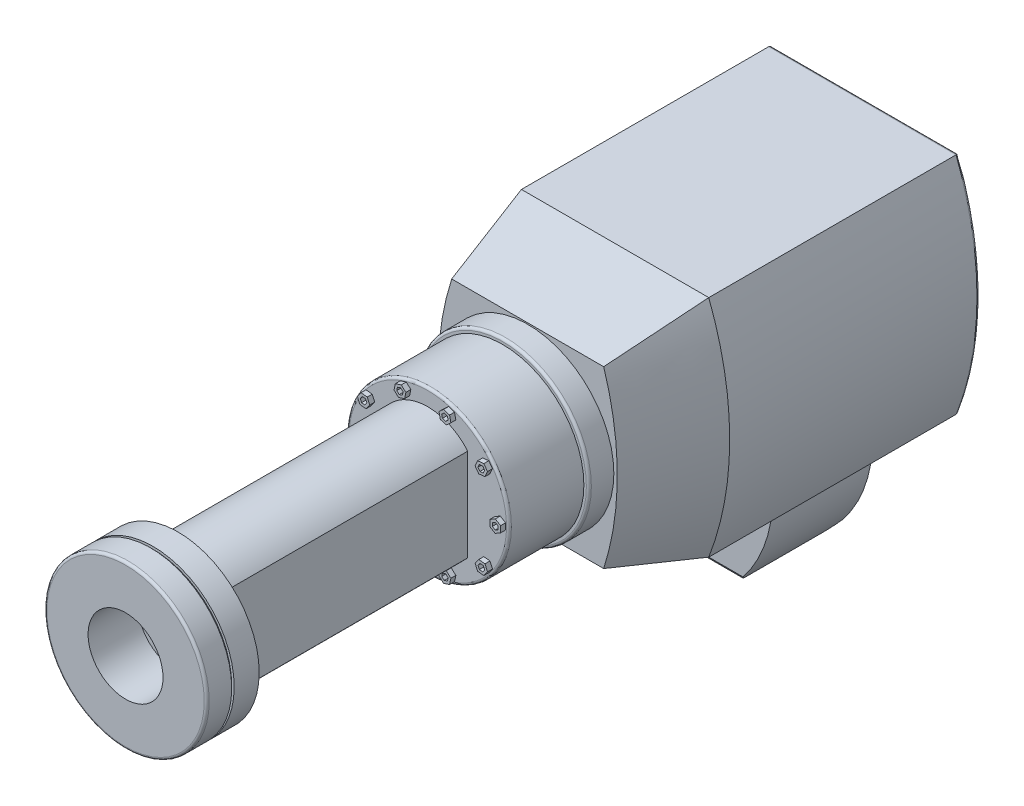
from build123d import *

# Parameters (mm, degrees)
BOSS_EXTRUDE1_DEPTH  = 100
SKETCH4_R            = 34.5
BOSS_EXTRUDE2_DEPTH  = 10
SKETCH5_R            = 32.5
BOSS_EXTRUDE3_DEPTH  = 30
BOSS_EXTRUDE4_DEPTH  = 2
CIRPATTERN1_COUNT    = 10
BOSS_EXTRUDE5_DEPTH  = 100
SKETCH11_R           = 32.5
BOSS_EXTRUDE6_DEPTH  = 10
SKETCH12_R           = 31.5
BOSS_EXTRUDE7_DEPTH  = 1
SKETCH13_R           = 32.5
BOSS_EXTRUDE8_DEPTH  = 10
SKETCH14_R           = 42.5
BOSS_EXTRUDE9_DEPTH  = 10.5
BOSS_EXTRUDE10_DEPTH = 35
BOSS_EXTRUDE11_DEPTH = 20
CUT_EXTRUDE1_DEPTH   = 314.700892617
FILLET1_R            = 1
SKETCH18_R           = 15
CUT_EXTRUDE2_DEPTH   = 20
SKETCH19_R           = 15
CUT_EXTRUDE3_DEPTH   = 20


with BuildPart() as part:
    # Sketch1 → Boss-Extrude1 (new body)
    with BuildSketch(Plane.XY):
        with BuildLine():
            Line((37.5, 45), (-37.5, 45))
            ThreePointArc((-37.5, 45), (-45.880962103, 0), (-37.5, -45))
            Line((-37.5, -45), (37.5, -45))
            ThreePointArc((37.5, -45), (45.880962103, 0), (37.5, 45))
        make_face()
    extrude(amount=BOSS_EXTRUDE1_DEPTH)

    # Sketch3 for Loft1 → Loft1 section 0
    with BuildSketch(Plane.XY.offset(135)):
        with BuildLine():
            Line((30.425473604, 35), (-30.425473604, 35))
            # circular arc as an exact rational Bezier (weights 1, cos(half-angle), 1)
            Bezier((-30.425473604, 35), (-41.608142487, 0), (-30.425473604, -35), weights=[1, 0.95256097, 1])
            Line((-30.425473604, -35), (30.425473604, -35))
            Bezier((30.425473604, -35), (41.608142487, 0), (30.425473604, 35), weights=[1, 0.95256097, 1])
        make_face()
    # Sketch2 for Loft1 → Loft1 section 1
    with BuildSketch(Plane.XY.offset(100)):
        with BuildLine():
            Line((37.5, 45), (-37.5, 45))
            Bezier((-37.5, 45), (-54.864231746, 0), (-37.5, -45), weights=[1, 0.932952303, 1])
            Line((-37.5, -45), (37.5, -45))
            Bezier((37.5, -45), (54.864231746, 0), (37.5, 45), weights=[1, 0.932952303, 1])
        make_face()
    loft()

    # Sketch4 → Boss-Extrude2 (add)
    with BuildSketch(Plane.XY.offset(135)):
        Circle(SKETCH4_R)
    extrude(amount=BOSS_EXTRUDE2_DEPTH)

    # Sketch5 → Boss-Extrude3 (add)
    with BuildSketch(Plane.XY.offset(145)):
        Circle(SKETCH5_R)
    extrude(amount=BOSS_EXTRUDE3_DEPTH)

    # Sketch6 → Boss-Extrude4 (add)
    with BuildSketch(Plane.XY.offset(175)):
        Polygon((29, -2.5), (31.165063509, -1.25), (31.165063509, 1.25), (29, 2.5), (26.834936491, 1.25), (26.834936491, -1.25), align=None)
        Polygon((30.165063509, 0.672649731), (29, 1.345299462), (27.834936491, 0.672649731), (27.834936491, -0.672649731), (29, -1.345299462), (30.165063509, -0.672649731), align=None, mode=Mode.SUBTRACT)
    boss_extrude4 = extrude(amount=BOSS_EXTRUDE4_DEPTH)

    # CirPattern1: Boss-Extrude4 ×10 about axis
    cirpattern1_axis = Axis((-0.142607945, 0, 0), (0, 0, 1))
    for i in range(1, CIRPATTERN1_COUNT):
        add(boss_extrude4.rotate(cirpattern1_axis, i * 360 / CIRPATTERN1_COUNT))

    # Sketch9 → Boss-Extrude5 (add)
    with BuildSketch(Plane.XY.offset(175)):
        with BuildLine():
            Line((16, 18.5), (16, -18.5))
            ThreePointArc((16, -18.5), (0, -25.898529491), (-16, -18.5))
            Line((-16, -18.5), (-16, 18.5))
            ThreePointArc((-16, 18.5), (0, 25.898529491), (16, 18.5))
        make_face()
    extrude(amount=BOSS_EXTRUDE5_DEPTH)

    # Sketch11 → Boss-Extrude6 (add)
    with BuildSketch(Plane.XY.offset(275)):
        Circle(SKETCH11_R)
    extrude(amount=BOSS_EXTRUDE6_DEPTH)

    # Sketch12 → Boss-Extrude7 (add)
    with BuildSketch(Plane.XY.offset(285)):
        Circle(SKETCH12_R)
    extrude(amount=BOSS_EXTRUDE7_DEPTH)

    # Sketch13 → Boss-Extrude8 (add)
    with BuildSketch(Plane.XY.offset(286)):
        Circle(SKETCH13_R)
    extrude(amount=BOSS_EXTRUDE8_DEPTH)

    # Sketch14 → Boss-Extrude9 (add, symmetric)
    with BuildSketch(Plane(origin=(-37.5, 0, 0), x_dir=(0, 0, -1), z_dir=(1, 0, 0))):
        with Locations((-50, -45)):
            Circle(SKETCH14_R)
    extrude(amount=BOSS_EXTRUDE9_DEPTH, both=True)

    # Sketch15 → Boss-Extrude10 (add)
    with BuildSketch(Plane(origin=(-27, 0, 0), x_dir=(0, 0, -1), z_dir=(1, 0, 0))):
        with BuildLine():
            Line((-70, -45), (-70, -75))
            ThreePointArc((-70, -75), (-50, -85.128852225), (-30, -75))
            Line((-30, -75), (-30, -45))
            Line((-30, -45), (-70, -45))
        make_face()
    extrude(amount=BOSS_EXTRUDE10_DEPTH)

    # Sketch16 → Boss-Extrude11 (add, symmetric)
    with BuildSketch(Plane.XY.offset(50)):
        with BuildLine():
            Line((8, -45), (8, -87))
            ThreePointArc((8, -87), (25.421855105, -68.929675658), (33, -45))
            Line((33, -45), (8, -45))
        make_face()
    extrude(amount=BOSS_EXTRUDE11_DEPTH, both=True)

    # Sketch17 → Cut-Extrude1 (cut, through all)
    with BuildSketch(Plane.ZY.offset(-8)):
        with BuildLine():
            Line((70, -87), (70, -75))
            ThreePointArc((70, -75), (50, -85.128852225), (30, -75))
            Line((30, -75), (30, -87))
            Line((30, -87), (70, -87))
        make_face()
    extrude(amount=-CUT_EXTRUDE1_DEPTH, mode=Mode.SUBTRACT)

    # Fillet1
    fillet1_edges = [part.edges().sort_by_distance(p)[0] for p in [
        (-34.5, 0, 145),
        (-32.5, 0, 175),
        (-32.5, 0, 296),
        (-48, -45, 92.5),
        (-27, -87.5, 50),
        (0, -45, 0),
        (-45.880962103, 0, 0),
        (0, 45, 0),
        (45.880962103, 0, 0),
    ]]
    fillet(fillet1_edges, radius=FILLET1_R)

    # Sketch18 → Cut-Extrude2 (cut)
    with BuildSketch(Plane.XY.offset(296)):
        Circle(SKETCH18_R)
    extrude(amount=-CUT_EXTRUDE2_DEPTH, mode=Mode.SUBTRACT)

    # Sketch19 → Cut-Extrude3 (cut)
    with BuildSketch(Plane.ZY.offset(48)):
        with Locations((50, -45)):
            Circle(SKETCH19_R)
    extrude(amount=-CUT_EXTRUDE3_DEPTH, mode=Mode.SUBTRACT)


solid = part.part
